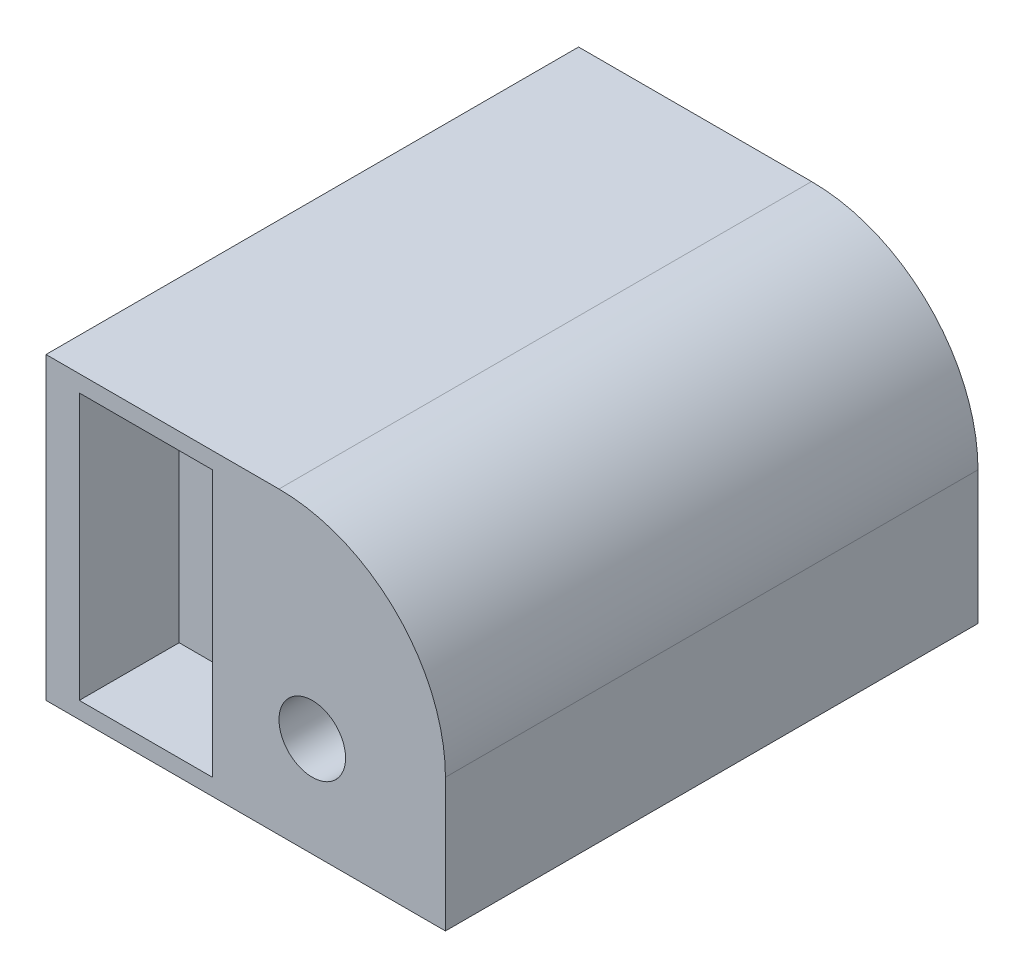
from build123d import *

# Parameters (mm, degrees)
SKETCH1_W           = 76.2
SKETCH1_H           = 57.15
SKETCH1_R           = 6.35
BOSS_EXTRUDE1_DEPTH = 101.6
SKETCH2_W           = 50.8
SKETCH2_H           = 25.4
CUT_EXTRUDE1_DEPTH  = 19.05
SKETCH3_W           = 25.4
SKETCH3_H           = 50.8
CUT_EXTRUDE2_DEPTH  = 19.05
SKETCH4_R           = 6.35
BOSS_EXTRUDE2_DEPTH = 2.54
FILLET1_R           = 31.75


with BuildPart() as part:
    # Sketch1 → Boss-Extrude1 (new body)
    with BuildSketch(Plane.XY):
        with Locations((-4.930961298, 9.873813983)):
            Rectangle(SKETCH1_W, SKETCH1_H)
        with Locations((7.769038702, 0.348813983)):
            Circle(SKETCH1_R, mode=Mode.SUBTRACT)
    extrude(amount=BOSS_EXTRUDE1_DEPTH)

    # Sketch2 → Cut-Extrude1 (cut)
    with BuildSketch(Plane.ZY.offset(43.030961298)):
        with Locations((31.75, 9.873813983)):
            Rectangle(SKETCH2_W, SKETCH2_H)
    extrude(amount=-CUT_EXTRUDE1_DEPTH, mode=Mode.SUBTRACT)

    # Sketch3 → Cut-Extrude2 (cut)
    with BuildSketch(Plane.XY.offset(101.6)):
        with Locations((-23.980961298, 9.873813983)):
            Rectangle(SKETCH3_W, SKETCH3_H)
    extrude(amount=-CUT_EXTRUDE2_DEPTH, mode=Mode.SUBTRACT)

    # Sketch4 → Boss-Extrude2 (add)
    with BuildSketch(Plane.ZY.offset(23.980961298)):
        with Locations(Location((44.45, 9.873813983, 0), (0, 0, 270))):
            Circle(SKETCH4_R)
    extrude(amount=BOSS_EXTRUDE2_DEPTH)

    # Fillet1
    fillet1_edges = [part.edges().sort_by_distance(p)[0] for p in [
        (33.169038702, 38.448813983, 50.8),
    ]]
    fillet(fillet1_edges, radius=FILLET1_R)


solid = part.part
